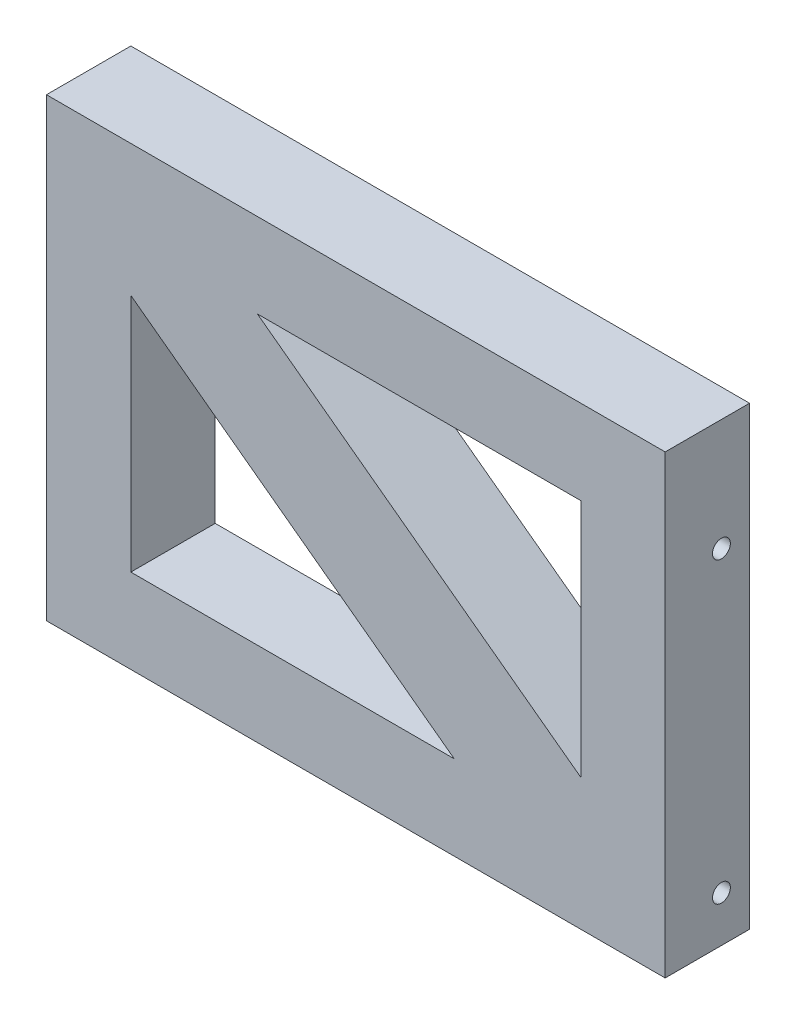
from build123d import *

# Parameters (mm, degrees)
SKETCH1_W                            = 139.7
SKETCH1_H                            = 102.87
BOSS_EXTRUDE1_DEPTH                  = 19.05
F_10_32_TAPPED_HOLE2_D               = 4.0386
F_10_32_TAPPED_HOLE2_DEPTH           = 13.716
F_10_32_TAPPED_HOLE2_TIP             = 1.213317848
F_10_32_TAPPED_HOLE2_ON_FACE_2_D     = 4.0386
F_10_32_TAPPED_HOLE2_ON_FACE_2_DEPTH = 13.716
F_10_32_TAPPED_HOLE2_ON_FACE_2_TIP   = 1.213317848


with BuildPart() as part:
    # Sketch1 → Boss-Extrude1 (new body)
    with BuildSketch(Plane.XY):
        with Locations((69.85, 51.435)):
            Rectangle(SKETCH1_W, SKETCH1_H)
        Polygon((19.05, 19.05), (19.05, 73.152), (92.075, 19.05), align=None, mode=Mode.SUBTRACT)
        Polygon((120.65, 83.82), (120.65, 29.718), (47.625, 83.82), align=None, mode=Mode.SUBTRACT)
    extrude(amount=BOSS_EXTRUDE1_DEPTH)

    # #10-32 Tapped Hole2
    with Locations(Plane(origin=(0, 77.63256, 6.35), x_dir=(0, 0, -1), z_dir=(-1, 0, 0))):
        with Locations((0, 0), (0, 67.31)):
            Hole(F_10_32_TAPPED_HOLE2_D / 2, depth=F_10_32_TAPPED_HOLE2_DEPTH)
            with Locations((0, 0, -(F_10_32_TAPPED_HOLE2_DEPTH + F_10_32_TAPPED_HOLE2_TIP / 2))):  # 118° drill point
                Cone(0, F_10_32_TAPPED_HOLE2_D / 2, F_10_32_TAPPED_HOLE2_TIP, mode=Mode.SUBTRACT)

    # #10-32 Tapped Hole2 on face 2
    with Locations(Plane(origin=(139.7, 10.32256, 6.35), x_dir=(0, 0, 1), z_dir=(1, 0, 0))):
        with Locations((0, 0), (0, -67.31)):
            Hole(F_10_32_TAPPED_HOLE2_ON_FACE_2_D / 2, depth=F_10_32_TAPPED_HOLE2_ON_FACE_2_DEPTH)
            with Locations((0, 0, -(F_10_32_TAPPED_HOLE2_ON_FACE_2_DEPTH + F_10_32_TAPPED_HOLE2_ON_FACE_2_TIP / 2))):  # 118° drill point
                Cone(0, F_10_32_TAPPED_HOLE2_ON_FACE_2_D / 2, F_10_32_TAPPED_HOLE2_ON_FACE_2_TIP, mode=Mode.SUBTRACT)


solid = part.part
